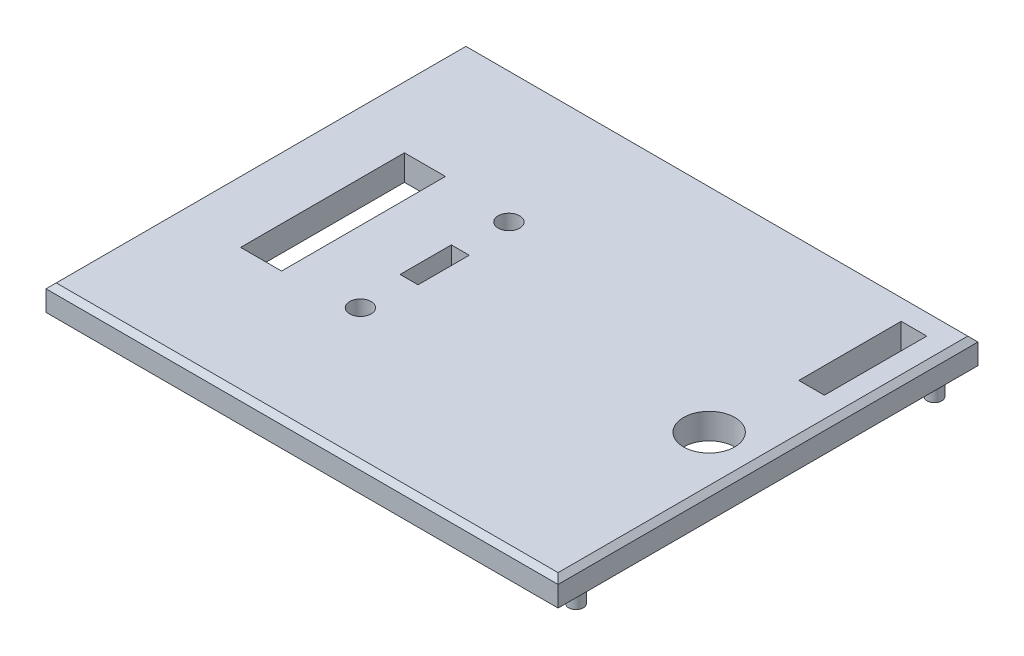
from build123d import *

# Parameters (mm, degrees)
SKETCH1_R           = 5
SKETCH1_R_2         = 2.1
SKETCH1_W           = 5
SKETCH1_H           = 20
SKETCH1_W_2         = 8
SKETCH1_H_2         = 32
SKETCH1_W_3         = 3.5
SKETCH1_H_3         = 10
BOSS_EXTRUDE1_DEPTH = 5
CHAMFER1_SIZE       = 1
SKETCH3_R           = 1.435
BOSS_EXTRUDE2_DEPTH = 3.5


with BuildPart() as part:
    # Sketch1 → Boss-Extrude1 (new body)
    with BuildSketch(Plane(origin=(0, 0, 0), x_dir=(1, 0, 0), z_dir=(0, 1, 0))):
        Polygon((50, 16), (50, -41), (-50, -41), (-50, 41), (50, 41), (50, 36), align=None)
        with Locations(Location((40, -1.5, 0), (0, 0, 270))):
            Circle(SKETCH1_R, mode=Mode.SUBTRACT)
        with Locations(Location((-15.1, 14.5, 0), (0, 0, 270))):
            Circle(SKETCH1_R_2, mode=Mode.SUBTRACT)
        with Locations(Location((-15.1, -14.5, 0), (0, 0, 270))):
            Circle(SKETCH1_R_2, mode=Mode.SUBTRACT)
        with Locations((42.5, 26)):
            Rectangle(SKETCH1_W, SKETCH1_H, mode=Mode.SUBTRACT)
        with Locations((-33, 0)):
            Rectangle(SKETCH1_W_2, SKETCH1_H_2, mode=Mode.SUBTRACT)
        with Locations((-15.1, 0)):
            Rectangle(SKETCH1_W_3, SKETCH1_H_3, mode=Mode.SUBTRACT)
    extrude(amount=BOSS_EXTRUDE1_DEPTH)

    # Chamfer1
    chamfer1_edges = [part.edges().sort_by_distance(p)[0] for p in [
        (50, 5, 0),
        (0, 5, -41),
        (-50, 5, 0),
        (0, 5, 41),
    ]]
    chamfer(chamfer1_edges, length=CHAMFER1_SIZE)

    # Sketch3 → Boss-Extrude2 (add)
    with BuildSketch(Plane.XZ):
        with Locations(Location((47.5, 35, 0), (0, 0, 90))):
            Circle(SKETCH3_R)
        with Locations(Location((-47.5, 35, 0), (0, 0, 270))):
            Circle(SKETCH3_R)
        with Locations(Location((47.5, -35, 0), (0, 0, 270))):
            Circle(SKETCH3_R)
        with Locations(Location((-47.5, -35, 0), (0, 0, 90))):
            Circle(SKETCH3_R)
    extrude(amount=BOSS_EXTRUDE2_DEPTH)


solid = part.part
